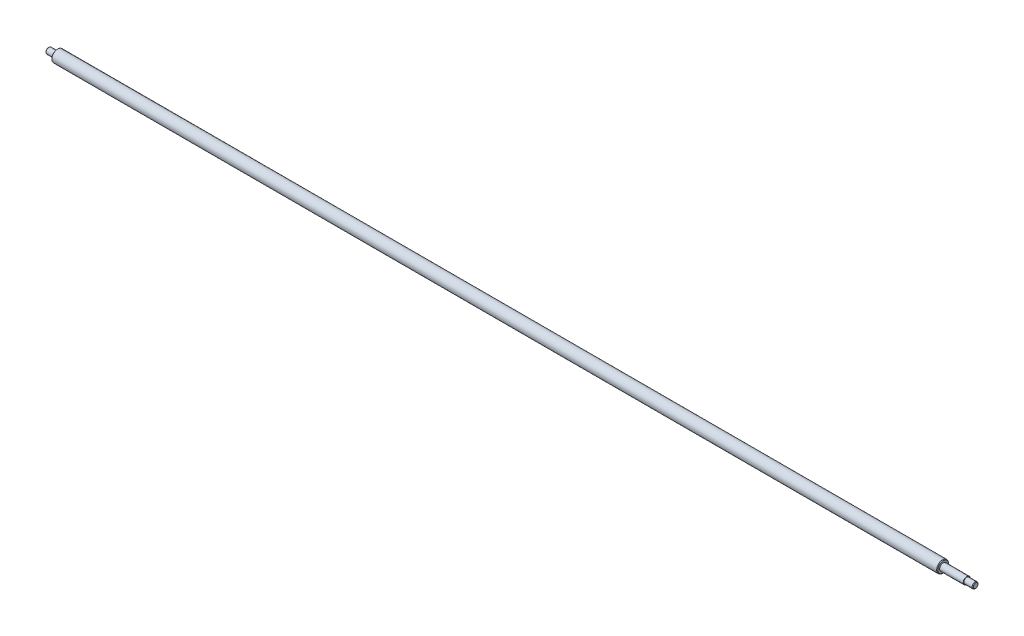
from build123d import *

# Parameters (mm, degrees)
SKETCH_1_R      = 10
EXTRUDE_1_DEPTH = 1500
SKETCH_2_R      = 5
EXTRUDE_3_DEPTH = 15
SKETCH_3_R      = 6
EXTRUDE_4_DEPTH = 40
EXTRUDE_START   = 15
SKETCH_4_R      = 5
EXTRUDE_5_DEPTH = 15
CHAMFER_4_SIZE  = 1
CHAMFER_5_SIZE  = 1


with BuildPart() as part:
    # Эскиз1 → Бобышка-Вытянуть1 (new body)
    with BuildSketch(Plane(origin=(0, 0, 0), x_dir=(0, 0, -1), z_dir=(1, 0, 0))):
        Circle(SKETCH_1_R)
    extrude(amount=EXTRUDE_1_DEPTH)

    # Эскиз2 → Бобышка-Вытянуть3 (add)
    with BuildSketch(Plane.ZY):
        with Locations(Location((0, 0, 0), (0, 0, 180))):
            Circle(SKETCH_2_R)
    extrude(amount=EXTRUDE_3_DEPTH)

    # Эскиз3 → Бобышка-Вытянуть4 (add)
    with BuildSketch(Plane(origin=(1500, 0, 0), x_dir=(0, 0, -1), z_dir=(1, 0, 0))):
        Circle(SKETCH_3_R)
    extrude(amount=EXTRUDE_4_DEPTH)

    # Эскиз4 → Бобышка-Вытянуть5 (add)
    with BuildSketch(Plane(origin=(1540, 0, 0), x_dir=(0, 0, -1), z_dir=(1, 0, 0)).offset(EXTRUDE_START)):
        Circle(SKETCH_4_R)
    extrude(amount=-EXTRUDE_5_DEPTH)

    # Фаска4
    chamfer_4_edges = [part.edges().sort_by_distance(p)[0] for p in [
        (1555, 0, 5),
        (1500, 0, 10),
    ]]
    chamfer(chamfer_4_edges, length=CHAMFER_4_SIZE)

    # Фаска5
    chamfer_5_edges = [part.edges().sort_by_distance(p)[0] for p in [
        (0, 0, 10),
        (-15, 0, 5),
    ]]
    chamfer(chamfer_5_edges, length=CHAMFER_5_SIZE)


solid = part.part
